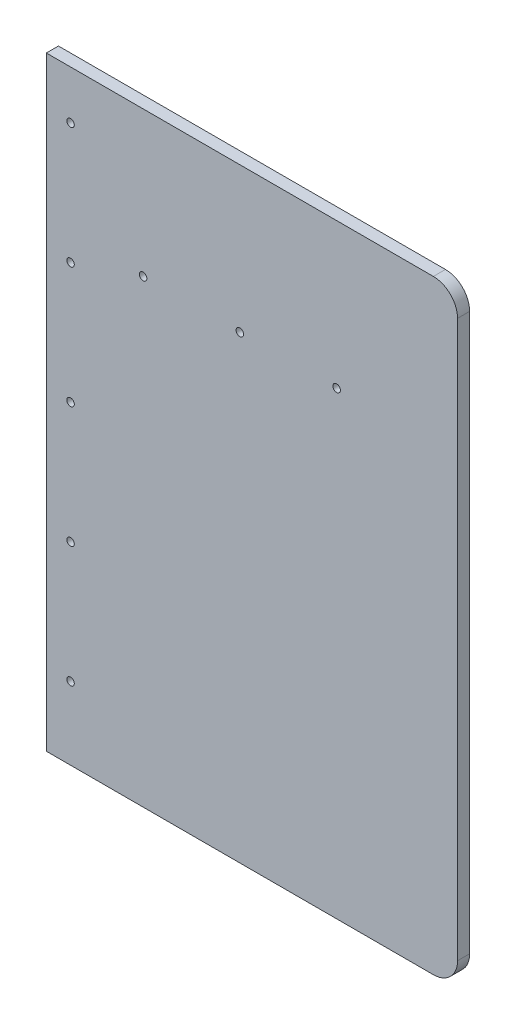
from build123d import *

# Parameters (mm, degrees)
CROQUIS1_R              = 1.55
SALIENTE_EXTRUIR1_DEPTH = 5


with BuildPart() as part:
    # Croquis1 → Saliente-Extruir1 (new body)
    with BuildSketch(Plane.XY):
        with BuildLine():
            Line((75, 125), (-85, 125))
            Line((-85, 125), (-85, -125))
            Line((-85, -125), (75, -125))
            ThreePointArc((75, -125), (82.071067812, -122.071067812), (85, -115))
            Line((85, -115), (85, 115))
            ThreePointArc((85, 115), (82.071067812, 122.071067812), (75, 125))
        make_face()
        with Locations((35, 65)):
            Circle(CROQUIS1_R, mode=Mode.SUBTRACT)
        with Locations((-75, 105)):
            Circle(CROQUIS1_R, mode=Mode.SUBTRACT)
        with Locations((-75, 55)):
            Circle(CROQUIS1_R, mode=Mode.SUBTRACT)
        with Locations((-75, 5)):
            Circle(CROQUIS1_R, mode=Mode.SUBTRACT)
        with Locations((-75, -45)):
            Circle(CROQUIS1_R, mode=Mode.SUBTRACT)
        with Locations((-75, -95)):
            Circle(CROQUIS1_R, mode=Mode.SUBTRACT)
        with Locations((-5, 65)):
            Circle(CROQUIS1_R, mode=Mode.SUBTRACT)
        with Locations((-45, 65)):
            Circle(CROQUIS1_R, mode=Mode.SUBTRACT)
    extrude(amount=SALIENTE_EXTRUIR1_DEPTH)


solid = part.part
